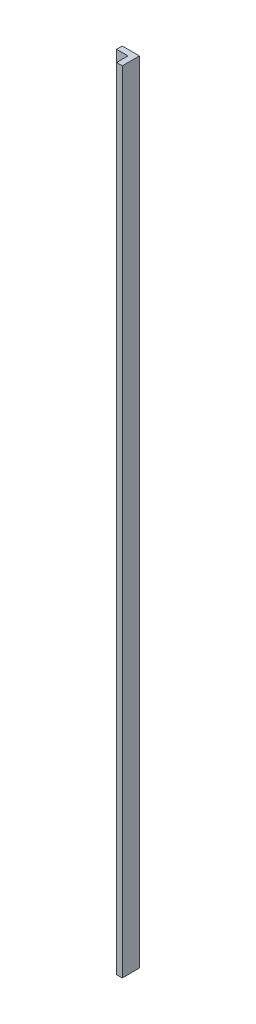
from build123d import *

# Parameters (mm, degrees)
BOSS_EXTRUDE1_DEPTH = 1380


with BuildPart() as part:
    # Sketch1 → Boss-Extrude1 (new body)
    with BuildSketch(Plane(origin=(0, 0, 0), x_dir=(1, 0, 0), z_dir=(0, 1, 0))):
        Polygon((0, 0), (-30, 0), (-30, -10), (-10, -10), (-10, -30), (0, -30), align=None)
    extrude(amount=BOSS_EXTRUDE1_DEPTH)


solid = part.part
